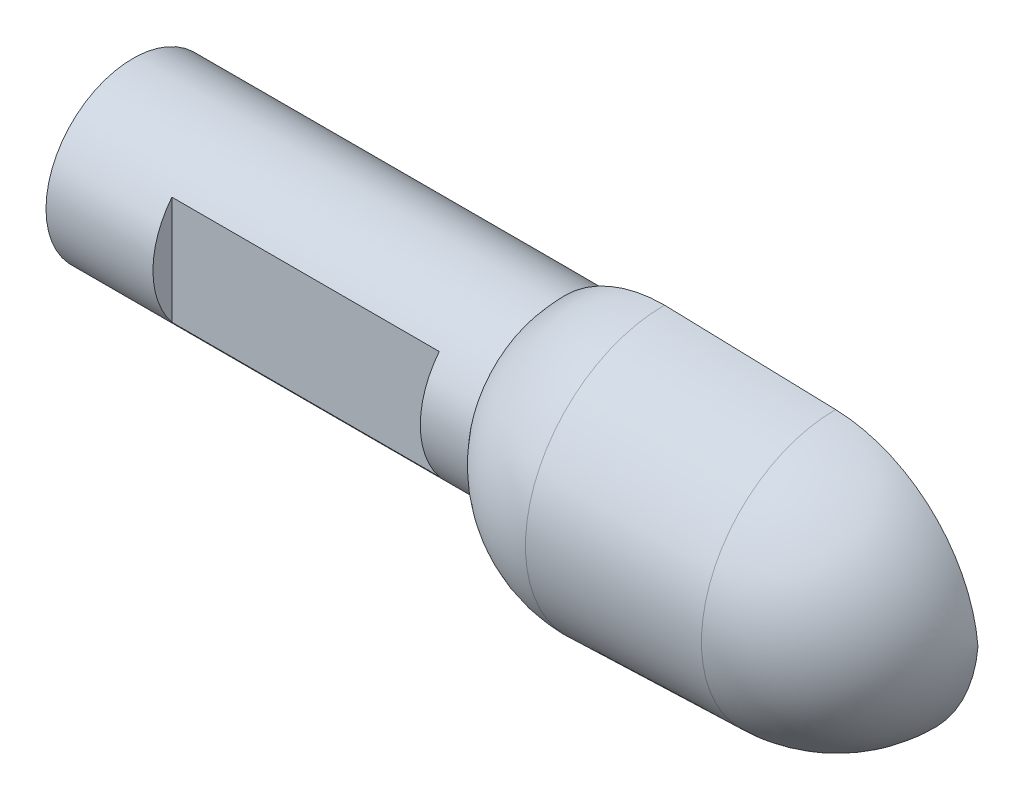
from build123d import *
from build123d.topology import SkipClean

# Parameters (mm, degrees)
CUT_EXTRUDE3_DEPTH = 17.226666346
CUT_EXTRUDE4_DEPTH = 10.882576389
CUT_EXTRUDE5_DEPTH = 1
CUT_EXTRUDE5_DRAFT = -25
CUT_EXTRUDE7_START = -7
CUT_EXTRUDE7_DEPTH = 5
CUT_EXTRUDE8_START = -1
CUT_EXTRUDE8_DEPTH = 6


with BuildPart() as part:
    # Sketch2 → Revolve1 (revolve)
    with BuildSketch(Plane.XY, mode=Mode.PRIVATE) as revolve1_sk:
        with BuildLine():
            Line((-6.63150289, 0), (-6.63150289, 1.625))
            Line((-6.63150289, 1.625), (1.26849711, 1.625))
            ThreePointArc((1.26849711, 1.625), (2.178863013, 2.343741755), (3.310095748, 2.6))
            Line((3.310095748, 2.6), (6.510095748, 2.50867829))
            ThreePointArc((6.510095748, 2.50867829), (8.318770507, 1.760874291), (9.17307545, 0))
            Line((9.17307545, 0), (-6.63150289, 0))
        make_face()
    revolve(revolve1_sk.sketch.rotate(Axis((-13.79438497, 0, 0), (1, 0, 0)), 90), axis=Axis((-13.79438497, 0, 0), (1, 0, 0)))

    # Sketch8 → Cut-Extrude3 (cut, through all)
    with SkipClean():  # the faces are left unmerged after this step: merging them gives an invalid solid
        with BuildSketch(Plane.ZY.offset(6.63150289)):
            with BuildLine():
                Line((0, -1.625), (0, -2.6))
                ThreePointArc((0, -2.6), (-2.6, 0), (0, 2.6))
                Line((0, 2.6), (0, 1.625))
                ThreePointArc((0, 1.625), (-1.625, 0), (0, -1.625))
            make_face()
        extrude(amount=-CUT_EXTRUDE3_DEPTH, mode=Mode.SUBTRACT)

    # Sketch9 → Cut-Extrude4 (cut, through all)
    with SkipClean():  # the faces are left unmerged after this step: merging them gives an invalid solid
        with BuildSketch(Plane(origin=(0, 0, 0), x_dir=(-1, 0, 0), z_dir=(0, 0, -1))):
            with BuildLine():
                Line((-1.26849711, 1.625), (-1.26849711, -1.625))
                Line((-1.26849711, -1.625), (-2.014389305, -1.625))
                ThreePointArc((-2.014389305, -1.625), (-4.93682915, -1.903834504), (-7.859268995, -1.625))
                Line((-7.859268995, -1.625), (-8.453314596, -1.625))
                ThreePointArc((-8.453314596, -1.625), (-9.31617507, 0), (-8.453314596, 1.625))
                Line((-8.453314596, 1.625), (-7.859268995, 1.625))
                ThreePointArc((-7.859268995, 1.625), (-4.926626022, 1.952572443), (-1.993983049, 1.625))
                Line((-1.993983049, 1.625), (-1.26849711, 1.625))
            make_face()
        extrude(amount=CUT_EXTRUDE4_DEPTH, mode=Mode.SUBTRACT)


with BuildPart() as cut_extrude5_tool:
    # Sketch10 → Cut-Extrude5 (with draft: the straight prism first)
    with BuildSketch(Plane(origin=(0, 0, 0), x_dir=(-1, 0, 0), z_dir=(0, 0, -1))):
        with BuildLine():
            ThreePointArc((-6.754616043, 1.962865993), (-8.41489063, 0), (-6.754616043, -1.962865993))
            Line((-6.754616043, -1.962865993), (-2.943623614, -1.962865993))
            ThreePointArc((-2.943623614, -1.962865993), (-1.898821514, 0), (-2.943623614, 1.962865993))
            Line((-2.943623614, 1.962865993), (-6.754616043, 1.962865993))
        make_face()
    extrude(amount=-CUT_EXTRUDE5_DEPTH)
    # Cut-Extrude5: the draft: its side faces are tilted about the plane it starts from
    cut_extrude5_sides = [cut_extrude5_tool.faces().sort_by_distance(p)[0] for p in [
        (4.849119829, -1.962865993, 0.5),
        (1.898821514, 0, 0.5),
        (4.849119829, 1.962865993, 0.5),
        (8.41489063, 0, 0.5),
    ]]
    draft(cut_extrude5_sides, Plane(origin=(0, 0, 0), x_dir=(-1, 0, 0), z_dir=(0, 0, -1)), CUT_EXTRUDE5_DRAFT)


with BuildPart() as part_1:
    add(part.part)

    # Cut-Extrude5: cut by cut_extrude5_tool
    add(cut_extrude5_tool.part, mode=Mode.SUBTRACT)

    # Sketch13 → Cut-Extrude7 (cut)
    with BuildSketch(Plane.ZY.offset(6.63150289).offset(CUT_EXTRUDE7_START)):
        with BuildLine():
            Line((1.270607087, -1.013006727), (1.270607087, 1.013006727))
            ThreePointArc((1.270607087, 1.013006727), (1.625, 0), (1.270607087, -1.013006727))
        make_face()
    extrude(amount=CUT_EXTRUDE7_DEPTH, mode=Mode.SUBTRACT)

    # Sketch14 → Cut-Extrude8 (cut)
    with BuildSketch(Plane(origin=(1.26849711, 0, 0), x_dir=(0, 0, -1), z_dir=(1, 0, 0)).offset(CUT_EXTRUDE8_START)):
        with BuildLine():
            Line((1.153512248, 1.144567383), (1.153512248, -1.144567383))
            ThreePointArc((1.153512248, -1.144567383), (1.625, 0), (1.153512248, 1.144567383))
        make_face()
    extrude(amount=-CUT_EXTRUDE8_DEPTH, mode=Mode.SUBTRACT)


solid = part_1.part
